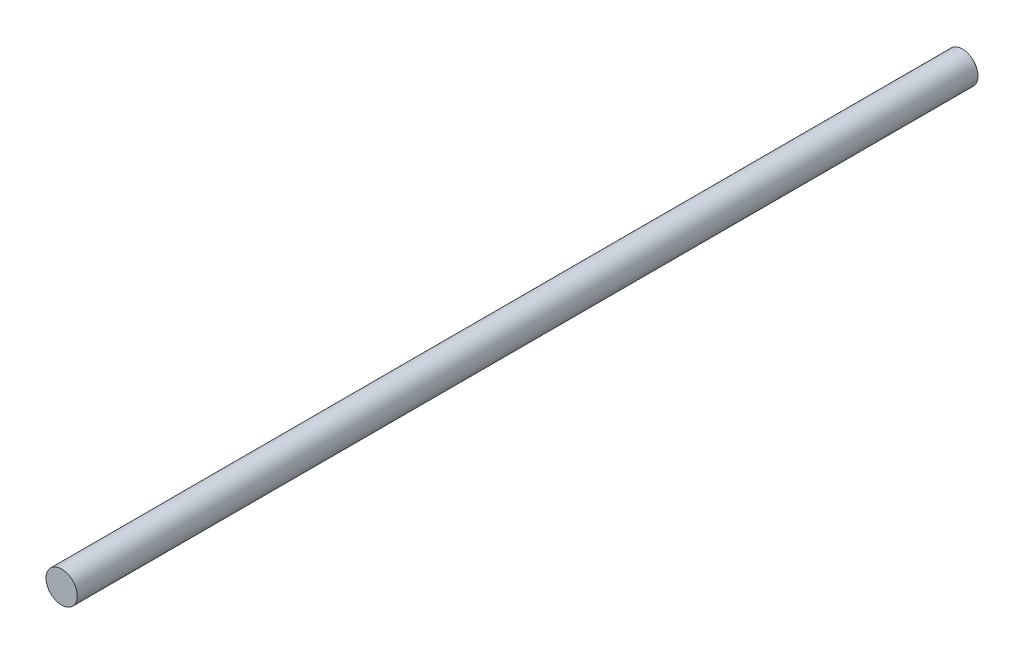
from build123d import *

# Parameters (mm, degrees)
SKETCH1_R           = 12.5
BOSS_EXTRUDE1_DEPTH = 720


with BuildPart() as part:
    # Sketch1 → Boss-Extrude1 (new body)
    with BuildSketch(Plane.XY):
        with Locations(Location((0, 0, 0), (0, 0, 180))):
            Circle(SKETCH1_R)
    extrude(amount=BOSS_EXTRUDE1_DEPTH)


solid = part.part
